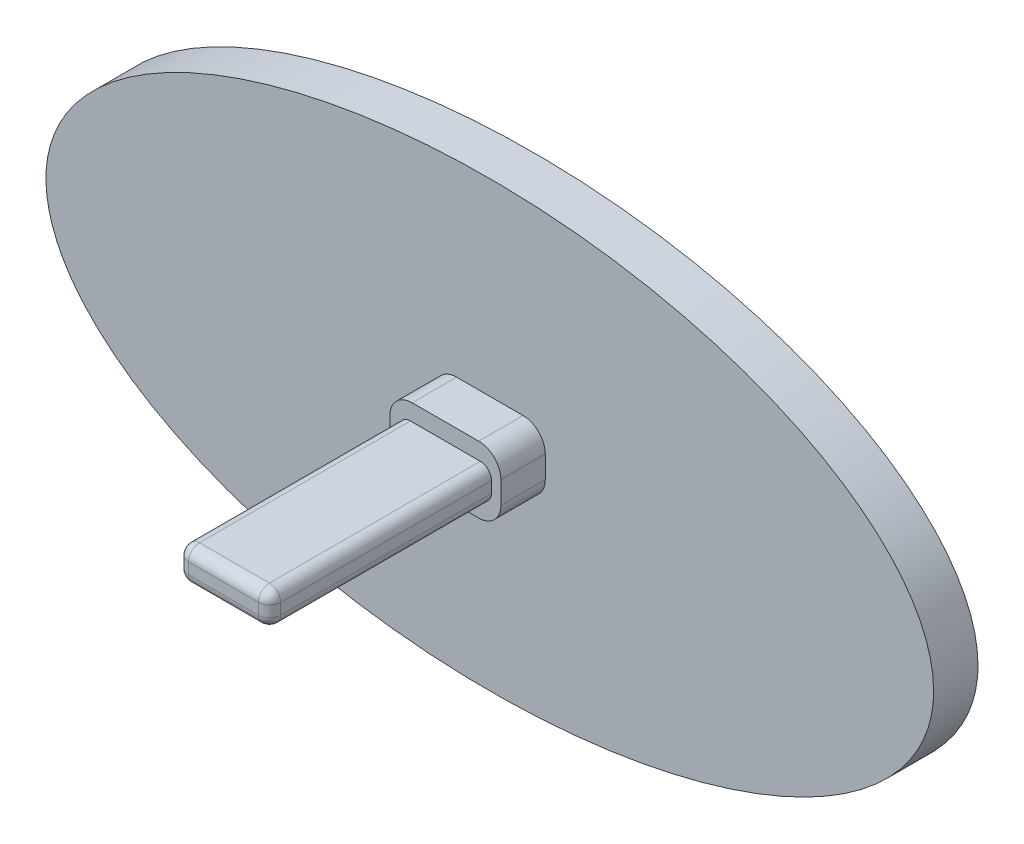
from build123d import *

# Parameters (mm, degrees)
SKETCH1_RX               = 20
SKETCH1_RY               = 10
BOSS_EXTRUDE1_DEPTH      = 2
BOSS_EXTRUDE2_DEPTH      = 1.5
BOSS_EXTRUDE2_DEPTH_BACK = 1.5
SKETCH2_W                = 5
SKETCH2_H                = 2
SKETCH3_W                = 4.15
SKETCH3_H                = 1.5
BOSS_EXTRUDE3_DEPTH      = 10
FILLET1_R                = 1
FILLET3_R                = 0.5


with BuildPart() as part:
    # Sketch1 → Boss-Extrude1 (new body)
    with BuildSketch(Plane.XY):
        with Locations((0, 0)):
            Ellipse(SKETCH1_RX, SKETCH1_RY)
    extrude(amount=BOSS_EXTRUDE1_DEPTH)

    # Sketch2 → Boss-Extrude2 (add, two sides: drawn at the far end of the back side and taken through both)
    with BuildSketch(Plane(origin=(0, 0, 0), x_dir=(1, 0, 0), z_dir=(0, 1, 0)).offset(-BOSS_EXTRUDE2_DEPTH_BACK)):
        with Locations((0, -3)):
            Rectangle(SKETCH2_W, SKETCH2_H)
    extrude(amount=BOSS_EXTRUDE2_DEPTH + BOSS_EXTRUDE2_DEPTH_BACK)

    # Sketch3 → Boss-Extrude3 (add)
    with BuildSketch(Plane.XY.offset(4)):
        Rectangle(SKETCH3_W, SKETCH3_H)
    extrude(amount=BOSS_EXTRUDE3_DEPTH)

    # Fillet1
    fillet1_edges = [part.edges().sort_by_distance(p)[0] for p in [
        (-2.5, -1.5, 3),
        (-2.5, 1.5, 3),
        (2.5, 1.5, 3),
        (2.5, -1.5, 3),
    ]]
    fillet(fillet1_edges, radius=FILLET1_R)

    # Fillet3
    fillet3_edges = [part.edges().sort_by_distance(p)[0] for p in [
        (0, 0.75, 14),
        (-2.075, 0, 14),
        (0, -0.75, 14),
        (2.075, 0, 14),
        (2.075, 0.75, 9),
        (2.075, -0.75, 9),
        (-2.075, 0.75, 9),
        (-2.075, -0.75, 9),
    ]]
    fillet(fillet3_edges, radius=FILLET3_R)


solid = part.part
